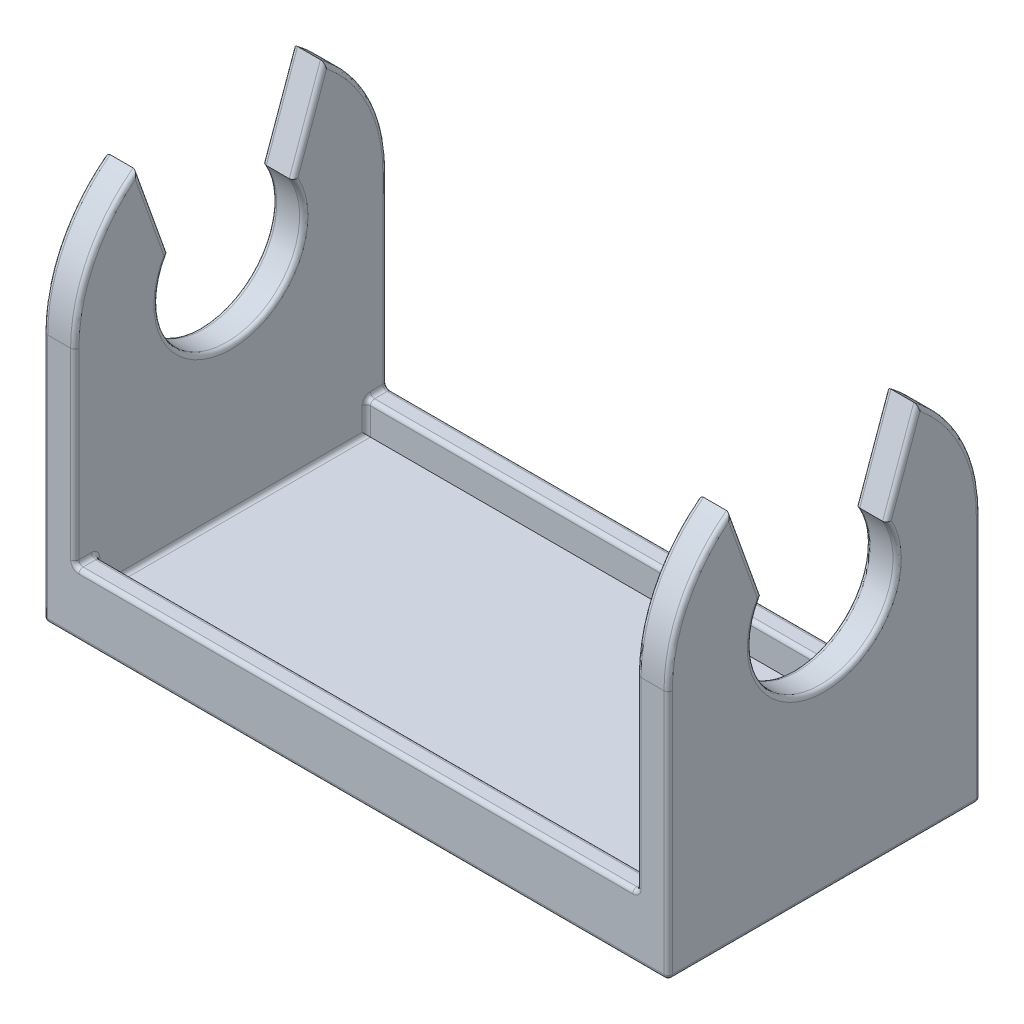
from build123d import *

# Parameters (mm, degrees)
EXTRUDE_1_DEPTH        = 30
CUT_EXTRUDE_1_REACH    = 40.066
SKETCH_2_W             = 27
SKETCH_2_H             = 16.5
SKETCH_3_W             = 27
SKETCH_3_H             = 1
EXTRUDE_2_DEPTH        = 1.5
EXTRUDE_3_DEPTH        = 2
PATTERN_LINEAR_1_COUNT = 2
PATTERN_LINEAR_1_PITCH = 15
CUT_EXTRUDE_2_DEPTH    = 36.780581326
FILLET_1_R             = 0.2
FILLET_2_R             = 0.1


with BuildPart() as part:
    # 草图1 → 凸台-拉伸1 (new body)
    with BuildSketch(Plane(origin=(0, 0, 0), x_dir=(0, 0, -1), z_dir=(1, 0, 0))):
        with BuildLine():
            Line((7.5, 0), (-7.5, 0))
            Line((-7.5, 0), (-7.5, 12))
            ThreePointArc((-7.5, 12), (-6.708203932, 15.354101966), (-4.5, 18))
            Line((-4.5, 18), (-3, 13.802775638))
            ThreePointArc((-3, 13.802775638), (0, 8.5), (3, 13.802775638))
            Line((3, 13.802775638), (4.5, 18))
            ThreePointArc((4.5, 18), (6.708203932, 15.354101966), (7.5, 12))
            Line((7.5, 12), (7.5, 0))
        make_face()
    extrude(amount=EXTRUDE_1_DEPTH)

    # 草图2 → 切除-拉伸1 (cut, up to next)
    with BuildSketch(Plane.XY.offset(7.5), mode=Mode.PRIVATE) as cut_extrude_1_sk1:
        with Locations((15, 9.75)):
            Rectangle(SKETCH_2_W, SKETCH_2_H)
    cut_extrude_1_tool1 = extrude(cut_extrude_1_sk1.sketch, amount=-CUT_EXTRUDE_1_REACH, mode=Mode.PRIVATE) & part.part
    add(cut_extrude_1_tool1.solids().sort_by_distance((15, 9.75, 7.5))[0], mode=Mode.SUBTRACT)

    # 草图3 → 凸台-拉伸2 (add)
    with BuildSketch(Plane(origin=(0, 1.5, 0), x_dir=(1, 0, 0), z_dir=(0, 1, 0))):
        with Locations((15, 7)):
            Rectangle(SKETCH_3_W, SKETCH_3_H)
        with Locations((15, -7)):
            Rectangle(SKETCH_3_W, SKETCH_3_H)
    extrude(amount=EXTRUDE_2_DEPTH)

    # 草图4 → 凸台-拉伸3 (add, symmetric)
    with BuildSketch(Plane.XY):
        with BuildLine():
            Line((6, 0), (9, 0))
            Line((9, 0), (9, -0.677124344))
            ThreePointArc((9, -0.677124344), (9.280042303, -1.088161527), (9.45, -1.555590279))
            Line((9.45, -1.555590279), (9.45, -2.5))
            Line((9.45, -2.5), (5.55, -2.5))
            Line((5.55, -2.5), (5.55, -1.555590279))
            ThreePointArc((5.55, -1.555590279), (5.719957697, -1.088161527), (6, -0.677124344))
            Line((6, -0.677124344), (6, 0))
        make_face()
    extrude_3 = extrude(amount=EXTRUDE_3_DEPTH, both=True)

    # 阵列(线性)1: 凸台-拉伸3 ×2
    with Locations(*[(i * PATTERN_LINEAR_1_PITCH, 0, 0) for i in range(1, PATTERN_LINEAR_1_COUNT)]):
        add(extrude_3)

    # 草图5 → 切除-拉伸2 (cut, through all)
    with BuildSketch(Plane.ZY):
        with BuildLine():
            Line((1.5, 0), (1.5, -0.677124344))
            ThreePointArc((1.5, -0.677124344), (1.780042303, -1.088161527), (1.95, -1.555590279))
            Line((1.95, -1.555590279), (1.95, -2.5))
            Line((1.95, -2.5), (2, -2.5))
            Line((2, -2.5), (2, 0))
            Line((2, 0), (1.5, 0))
        make_face()
        with BuildLine():
            Line((-2, 0), (-1.5, 0))
            Line((-1.5, 0), (-1.5, -0.677124344))
            ThreePointArc((-1.5, -0.677124344), (-1.780042303, -1.088161527), (-1.95, -1.555590279))
            Line((-1.95, -1.555590279), (-1.95, -2.5))
            Line((-1.95, -2.5), (-2, -2.5))
            Line((-2, -2.5), (-2, 0))
        make_face()
    extrude(amount=-CUT_EXTRUDE_2_DEPTH, mode=Mode.SUBTRACT)

    # 圆角1
    fillet_1_edges = [part.edges().sort_by_distance(p)[0] for p in [
        (30, 15.901387819, -3.75),
        (0, 15.354101966, -6.708203932),
        (0, 6, -7.5),
        (30, 8.5, 0),
        (15, 0, -7.5),
        (15, 0, 7.5),
        (30, 15.901387819, 3.75),
        (30, 15.354101966, 6.708203932),
        (30, 6, 7.5),
        (30, 0, 0),
        (28.5, 7.5, -7.5),
        (1.5, 15.354101966, -6.708203932),
        (28.5, 15.354101966, -6.708203932),
        (1.5, 15.901387819, -3.75),
        (28.5, 15.901387819, -3.75),
        (1.5, 8.5, 0),
        (28.5, 8.5, 0),
        (1.5, 15.901387819, 3.75),
        (28.5, 15.901387819, 3.75),
        (1.5, 15.354101966, 6.708203932),
        (28.5, 15.354101966, 6.708203932),
        (1.5, 7.5, 7.5),
        (30, 6, -7.5),
        (1.5, 1.5, 0),
        (28.5, 1.5, 0),
        (1.5, 7.5, -7.5),
        (1.5, 2.25, -6.5),
        (28.5, 2.25, -6.5),
        (1.5, 3, -7),
        (15, 3, -6.5),
        (28.5, 3, -7),
        (15, 3, -7.5),
        (28.5, 7.5, 7.5),
        (1.5, 2.25, 6.5),
        (28.5, 2.25, 6.5),
        (1.5, 3, 7),
        (15, 3, 7.5),
        (28.5, 3, 7),
        (30, 15.354101966, -6.708203932),
        (15, 3, 6.5),
        (0, 0, 0),
        (0, 6, 7.5),
        (0, 15.354101966, 6.708203932),
        (0, 15.901387819, 3.75),
        (0, 8.5, 0),
        (0, 15.901387819, -3.75),
    ]]
    fillet(fillet_1_edges, radius=FILLET_1_R)

    # 圆角2
    fillet_2_edges = [part.edges().sort_by_distance(p)[0] for p in [
        (24.45, -2.5, 0),
        (20.55, -2.5, 0),
        (9.45, -2.5, 0),
        (5.55, -2.5, 0),
        (7.5, -2.5, -1.95),
        (22.5, -2.5, -1.95),
        (7.5, -2.5, 1.95),
        (22.5, -2.5, 1.95),
    ]]
    fillet(fillet_2_edges, radius=FILLET_2_R)


solid = part.part
